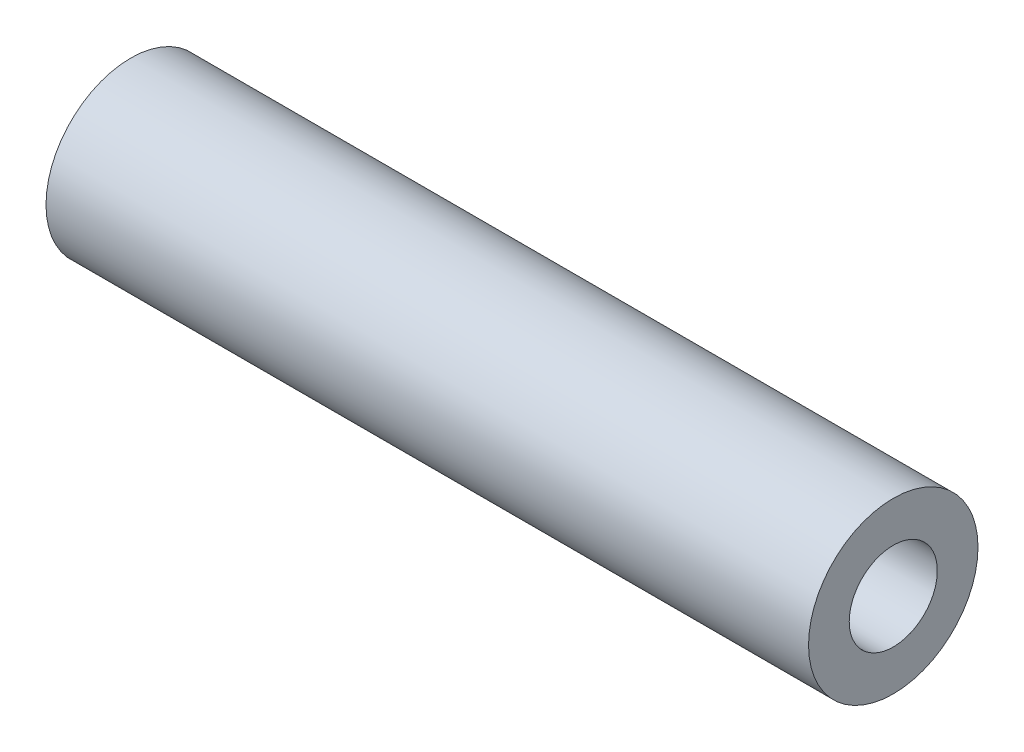
from build123d import *

# Parameters (mm, degrees)
SKETCH_1_R      = 5
SKETCH_1_R_2    = 2.6
EXTRUDE_1_DEPTH = 45


with BuildPart() as part:
    # 草图1 → 凸台-拉伸1 (new body)
    with BuildSketch(Plane(origin=(0, 0, 0), x_dir=(0, 0, -1), z_dir=(1, 0, 0))):
        with Locations(Location((0, 0, 0), (0, 0, 180))):
            Circle(SKETCH_1_R)
        with Locations(Location((0, 0, 0), (0, 0, 180))):
            Circle(SKETCH_1_R_2, mode=Mode.SUBTRACT)
    extrude(amount=EXTRUDE_1_DEPTH)


solid = part.part
